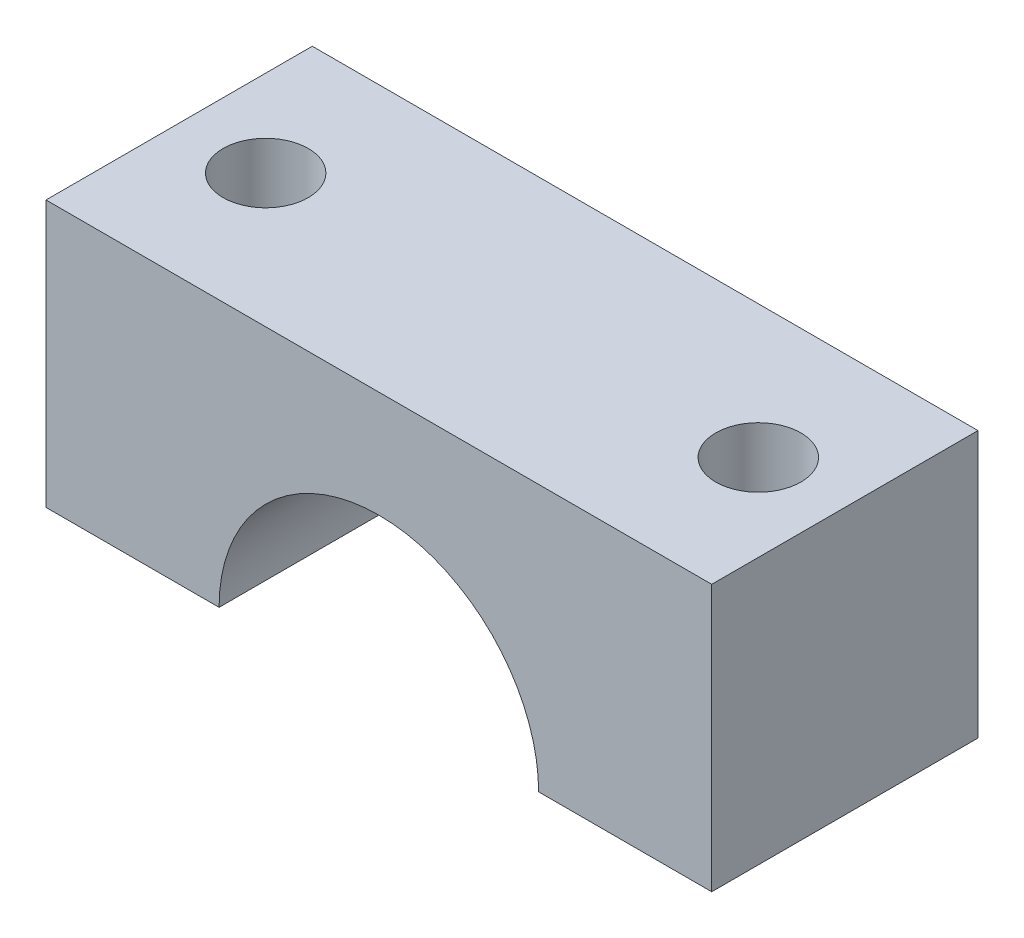
from build123d import *

# Parameters (mm, degrees)
SKETCH1_W           = 25
SKETCH1_H           = 10
BOSS_EXTRUDE1_DEPTH = 10
SKETCH2_R           = 1.6
CUT_EXTRUDE1_DEPTH  = 17.770509831
SKETCH3_R           = 6
CUT_EXTRUDE2_DEPTH  = 25


with BuildPart() as part:
    # Sketch1 → Boss-Extrude1 (new body)
    with BuildSketch(Plane(origin=(0, 0, 0), x_dir=(1, 0, 0), z_dir=(0, 1, 0))):
        Rectangle(SKETCH1_W, SKETCH1_H)
    extrude(amount=BOSS_EXTRUDE1_DEPTH)

    # Sketch2 → Cut-Extrude1 (cut, through all)
    with BuildSketch(Plane(origin=(0, 10, 0), x_dir=(1, 0, 0), z_dir=(0, 1, 0))):
        with Locations(Location((-9.25, 0, 0), (0, 0, 270))):
            Circle(SKETCH2_R)
        with Locations(Location((9.25, 0, 0), (0, 0, 270))):
            Circle(SKETCH2_R)
    extrude(amount=-CUT_EXTRUDE1_DEPTH, mode=Mode.SUBTRACT)

    # Sketch3 → Cut-Extrude2 (cut)
    with BuildSketch(Plane.XY.offset(5)):
        Circle(SKETCH3_R)
    extrude(amount=-CUT_EXTRUDE2_DEPTH, mode=Mode.SUBTRACT)


solid = part.part
